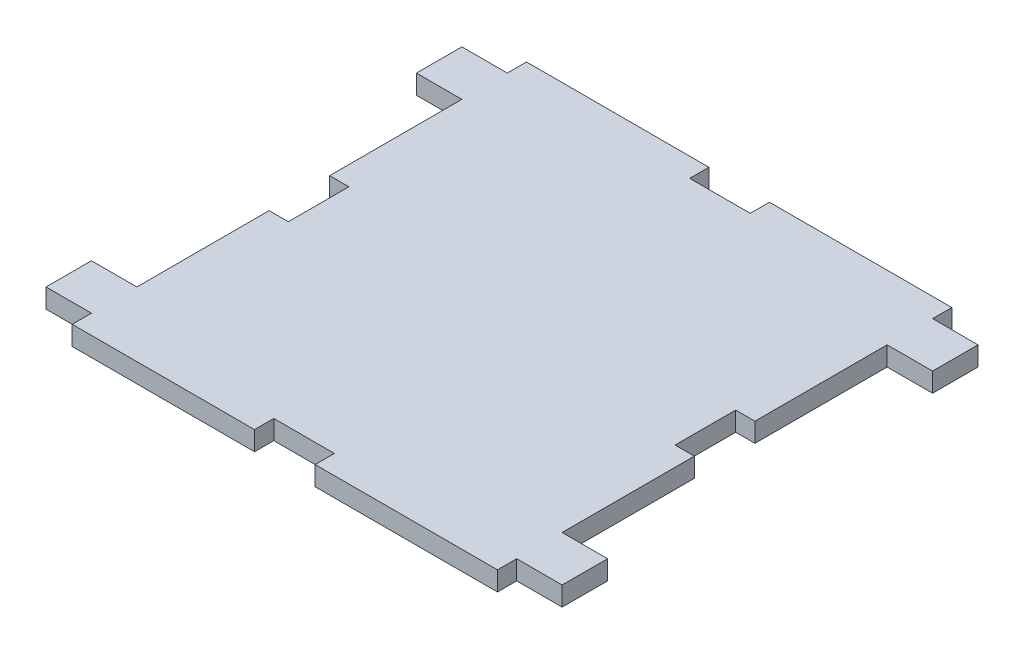
from build123d import *

# Parameters (mm, degrees)
SKETCH1_W           = 30
SKETCH1_H           = 42.7
BOSS_EXTRUDE1_DEPTH = 12.7
SKETCH2_W           = 40
SKETCH2_H           = 12.7
SKETCH2_W_2         = 12.7
SKETCH2_H_2         = 40
SKETCH2_W_3         = 30
CUT_EXTRUDE2_DEPTH  = 12.7


with BuildPart() as part:
    # Sketch1 → Boss-Extrude1 (new body)
    with BuildSketch(Plane(origin=(0, 0, 0), x_dir=(1, 0, 0), z_dir=(0, 1, 0))):
        Polygon((140.4, 150), (-140.4, 150), (-140.4, 107.3), (-140.4, -107.3), (-140.4, -150), (140.4, -150), (140.4, -107.3), (140.4, 107.3), align=None)
        with Locations((-155.4, 128.65)):
            Rectangle(SKETCH1_W, SKETCH1_H)
        with Locations((155.4, 128.65)):
            Rectangle(SKETCH1_W, SKETCH1_H)
        with Locations((-155.4, -128.65)):
            Rectangle(SKETCH1_W, SKETCH1_H)
        with Locations((155.4, -128.65)):
            Rectangle(SKETCH1_W, SKETCH1_H)
    extrude(amount=BOSS_EXTRUDE1_DEPTH)

    # Sketch2 → Cut-Extrude2 (cut)
    with BuildSketch(Plane(origin=(0, 12.7, 0), x_dir=(1, 0, 0), z_dir=(0, 1, 0))):
        with Locations((0, -143.65)):
            Rectangle(SKETCH2_W, SKETCH2_H)
        with Locations((-134.05, 0)):
            Rectangle(SKETCH2_W_2, SKETCH2_H_2)
        with Locations((134.05, 0)):
            Rectangle(SKETCH2_W_2, SKETCH2_H_2)
        with Locations((0, 143.65)):
            Rectangle(SKETCH2_W, SKETCH2_H)
        with Locations((-155.4, 143.65)):
            Rectangle(SKETCH2_W_3, SKETCH2_H)
        with Locations((155.4, 143.65)):
            Rectangle(SKETCH2_W_3, SKETCH2_H)
        with Locations((-155.4, -143.65)):
            Rectangle(SKETCH2_W_3, SKETCH2_H)
        with Locations((155.4, -143.65)):
            Rectangle(SKETCH2_W_3, SKETCH2_H)
    extrude(amount=-CUT_EXTRUDE2_DEPTH, mode=Mode.SUBTRACT)


solid = part.part
